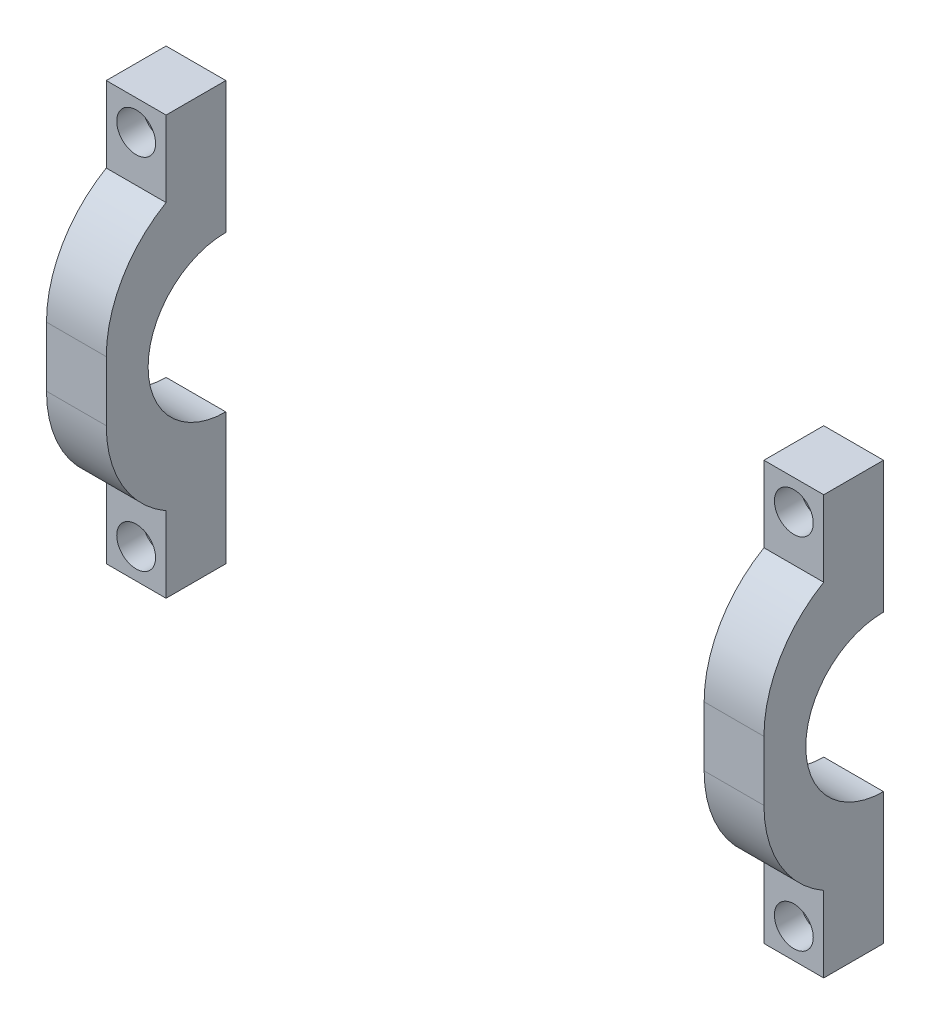
from build123d import *

# Parameters (mm, degrees)
AUFSATZ_LINEAR_AUSTRAGEN1_DEPTH            = 25
SCHNITT_LINEAR_AUSTRAGEN1_DEPTH            = 20
FASE1_SIZE                                 = 10
VERRUNDUNG1_R                              = 20
SKIZZE3_R                                  = 3.25
SCHNITT_LINEAR_AUSTRAGEN2_DEPTH            = 3.4
SKIZZE4_R                                  = 1.7
SCHNITT_LINEAR_AUSTRAGEN3_DEPTH            = 6.6
KREISMUSTER1_COUNT                         = 3
SKIZZE5_R                                  = 13
SCHNITT_LINEAR_AUSTRAGEN4_DEPTH            = 142.155942135
SKIZZE7_W                                  = 10
SKIZZE7_H                                  = 20
AUFSATZ_LINEAR_AUSTRAGEN2_DEPTH            = 10
SKIZZE9_R                                  = 1.7
SCHNITT_LINEAR_AUSTRAGEN7_DEPTH            = 81.156097709
SCHNITT_LINEAR_START                       = -4.4
SKIZZE8_R                                  = 3.25
SCHNITT_LINEAR_AUSTRAGEN6_DEPTH            = 97.187798753
SPIEGELN1_AT_THE_SECOND_PLANE_COPY_1_SKE_W = 10
SPIEGELN1_AT_THE_SECOND_PLANE_COPY_1_SKE_H = 20
SPIEGELN1_AT_THE_SECOND_PLANE_COPY_1_DEPTH = 10
SPIEGELN1_AT_THE_SECOND_PLANE_COPY_2_SKE_R = 1.7
SPIEGELN1_AT_THE_SECOND_PLANE_COPY_2_DEPTH = 81.156097709
SPIEGELN1_START                            = -4.4
SPIEGELN1_AT_THE_SECOND_PLANE_COPY_3_SKE_R = 3.25
SPIEGELN1_AT_THE_SECOND_PLANE_COPY_3_DEPTH = 97.187798753
SCHNITT_LINEAR_AUSTRAGEN5_DEPTH            = 99.615414617
SCHNITT_LINEAR_AUSTRAGEN5_DEPTH_BACK       = 99.615414617
SKIZZE6_W                                  = 120
SKIZZE6_H                                  = 50


with BuildPart() as part:
    # Skizze1 → Aufsatz-Linear austragen1 (new, symmetric)
    with BuildSketch(Plane(origin=(0, 0, 0), x_dir=(1, 0, 0), z_dir=(0, 1, 0))):
        Polygon((-60, 0), (60, 0), (60, -70), (50, -70), (50, -10), (-50, -10), (-50, -70), (-60, -70), align=None)
    extrude(amount=AUFSATZ_LINEAR_AUSTRAGEN1_DEPTH, both=True)

    # Skizze2 → Schnitt-Linear austragen1 (cut)
    with BuildSketch(Plane(origin=(0, 0, 0), x_dir=(-1, 0, 0), z_dir=(0, 0, -1))):
        with BuildLine():
            Line((-1.532970972, 2.1), (1.532970972, 2.1))
            ThreePointArc((1.532970972, 2.1), (0, -2.6), (-1.532970972, 2.1))
        make_face()
    extrude(amount=-SCHNITT_LINEAR_AUSTRAGEN1_DEPTH, mode=Mode.SUBTRACT)

    # Fase1
    fase1_edges = [part.edges().sort_by_distance(p)[0] for p in [
        (-60, 0, 0),
        (60, 0, 0),
        (50, 0, 10),
        (-50, 0, 10),
    ]]
    chamfer(fase1_edges, length=FASE1_SIZE)

    # Verrundung1
    verrundung1_edges = [part.edges().sort_by_distance(p)[0] for p in [
        (-55, -25, 70),
        (55, 25, 70),
        (-55, 25, 70),
        (55, -25, 70),
    ]]
    fillet(verrundung1_edges, radius=VERRUNDUNG1_R)

    # Skizze3 → Schnitt-Linear austragen2 (cut)
    with BuildSketch(Plane.XY.offset(10)):
        with Locations((0, 12)):
            Circle(SKIZZE3_R)
    schnitt_linear_austragen2 = extrude(amount=-SCHNITT_LINEAR_AUSTRAGEN2_DEPTH, mode=Mode.SUBTRACT)

    # Skizze4 → Schnitt-Linear austragen3 (cut)
    with BuildSketch(Plane.XY.offset(6.6)):
        with Locations((0, 12)):
            Circle(SKIZZE4_R)
    schnitt_linear_austragen3 = extrude(amount=-SCHNITT_LINEAR_AUSTRAGEN3_DEPTH, mode=Mode.SUBTRACT)

    # Kreismuster1: Schnitt-Linear austragen2, Schnitt-Linear austragen3 ×3 about axis
    kreismuster1_axis = Axis((0, 0, 0), (0, 0, 1))
    add([schnitt_linear_austragen2.rotate(kreismuster1_axis, i * 360 / KREISMUSTER1_COUNT) for i in range(1, KREISMUSTER1_COUNT)], mode=Mode.SUBTRACT)
    add([schnitt_linear_austragen3.rotate(kreismuster1_axis, i * 360 / KREISMUSTER1_COUNT) for i in range(1, KREISMUSTER1_COUNT)], mode=Mode.SUBTRACT)

    # Skizze5 → Schnitt-Linear austragen4 (cut, through all)
    with BuildSketch(Plane(origin=(60, 0, 0), x_dir=(0, 0, -1), z_dir=(1, 0, 0))):
        with Locations((-50, 0)):
            Circle(SKIZZE5_R)
    extrude(amount=-SCHNITT_LINEAR_AUSTRAGEN4_DEPTH, mode=Mode.SUBTRACT)

    # Skizze7 → Aufsatz-Linear austragen2 (add, symmetric)
    with BuildSketch(Plane(origin=(0, 25, 0), x_dir=(1, 0, 0), z_dir=(0, 1, 0))):
        with Locations((-55, -50)):
            Rectangle(SKIZZE7_W, SKIZZE7_H)
    aufsatz_linear_austragen2 = extrude(amount=AUFSATZ_LINEAR_AUSTRAGEN2_DEPTH, both=True)

    # Skizze9 → Schnitt-Linear austragen7 (cut, through all)
    with BuildSketch(Plane.XY.offset(40)):
        with Locations((-55, 30)):
            Circle(SKIZZE9_R)
    schnitt_linear_austragen7 = extrude(amount=SCHNITT_LINEAR_AUSTRAGEN7_DEPTH, mode=Mode.SUBTRACT)

    # Skizze8 → Schnitt-Linear austragen6 (cut)
    with BuildSketch(Plane.XY.offset(60).offset(SCHNITT_LINEAR_START)):
        with Locations((-55, 30)):
            Circle(SKIZZE8_R)
    schnitt_linear_austragen6 = extrude(amount=SCHNITT_LINEAR_AUSTRAGEN6_DEPTH, mode=Mode.SUBTRACT)

    # Spiegeln1: Aufsatz-Linear austragen2, Schnitt-Linear austragen7, Schnitt-Linear austragen6 across plane
    add(aufsatz_linear_austragen2.mirror(Plane(origin=(0, 0, 0), x_dir=(0, 0, 1), z_dir=(1, 0, 0))))
    add(schnitt_linear_austragen7.mirror(Plane(origin=(0, 0, 0), x_dir=(0, 0, 1), z_dir=(1, 0, 0))), mode=Mode.SUBTRACT)
    add(schnitt_linear_austragen6.mirror(Plane(origin=(0, 0, 0), x_dir=(0, 0, 1), z_dir=(1, 0, 0))), mode=Mode.SUBTRACT)

    # Spiegeln1 at the second plane: Aufsatz-Linear austragen2, Schnitt-Linear austragen7, Schnitt-Linear austragen6 across plane
    add(aufsatz_linear_austragen2.mirror(Plane.ZX))
    add(schnitt_linear_austragen7.mirror(Plane.ZX), mode=Mode.SUBTRACT)
    add(schnitt_linear_austragen6.mirror(Plane.ZX), mode=Mode.SUBTRACT)

    # Spiegeln1 at the second plane copy 1 ske → Spiegeln1 at the second plane copy 1 (add, symmetric)
    with BuildSketch(Plane(origin=(0, -25, 0), x_dir=(-1, 0, 0), z_dir=(0, -1, 0))):
        with Locations((-55, -50)):
            Rectangle(SPIEGELN1_AT_THE_SECOND_PLANE_COPY_1_SKE_W, SPIEGELN1_AT_THE_SECOND_PLANE_COPY_1_SKE_H)
    extrude(amount=SPIEGELN1_AT_THE_SECOND_PLANE_COPY_1_DEPTH, both=True)

    # Spiegeln1 at the second plane copy 2 ske → Spiegeln1 at the second plane copy 2 (cut, through all)
    with BuildSketch(Plane(origin=(0, 0, 40), x_dir=(-1, 0, 0), z_dir=(0, 0, 1))):
        with Locations((-55, 30)):
            Circle(SPIEGELN1_AT_THE_SECOND_PLANE_COPY_2_SKE_R)
    extrude(amount=SPIEGELN1_AT_THE_SECOND_PLANE_COPY_2_DEPTH, mode=Mode.SUBTRACT)

    # Spiegeln1 at the second plane copy 3 ske → Spiegeln1 at the second plane copy 3 (cut)
    with BuildSketch(Plane(origin=(0, 0, 60), x_dir=(-1, 0, 0), z_dir=(0, 0, 1)).offset(SPIEGELN1_START)):
        with Locations((-55, 30)):
            Circle(SPIEGELN1_AT_THE_SECOND_PLANE_COPY_3_SKE_R)
    extrude(amount=SPIEGELN1_AT_THE_SECOND_PLANE_COPY_3_DEPTH, mode=Mode.SUBTRACT)

    # Skizze6 → Schnitt-Linear austragen5 (cut, two sides: drawn at the far end of the back side and taken through both)
    with BuildSketch(Plane(origin=(0, 0, 0), x_dir=(1, 0, 0), z_dir=(0, 1, 0)).offset(-SCHNITT_LINEAR_AUSTRAGEN5_DEPTH_BACK)):
        with Locations((0, -25)):
            Rectangle(SKIZZE6_W, SKIZZE6_H)
    extrude(amount=SCHNITT_LINEAR_AUSTRAGEN5_DEPTH + SCHNITT_LINEAR_AUSTRAGEN5_DEPTH_BACK, mode=Mode.SUBTRACT)


with BuildPart() as schnitt_linear_austragen5_piece_1:
    # of the separate pieces the step leaves, piece 1, a body of its own (schnitt_linear_austragen5_pieces)
    add(part.part.solids().sort_by_distance((-50, 35, 50))[0])


with BuildPart() as schnitt_linear_austragen5_piece_2:
    # of the separate pieces the step leaves, piece 2, a body of its own (schnitt_linear_austragen5_pieces)
    add(part.part.solids().sort_by_distance((50, -22.320508076, 60))[0])


solid = Compound([schnitt_linear_austragen5_piece_1.part, schnitt_linear_austragen5_piece_2.part])
